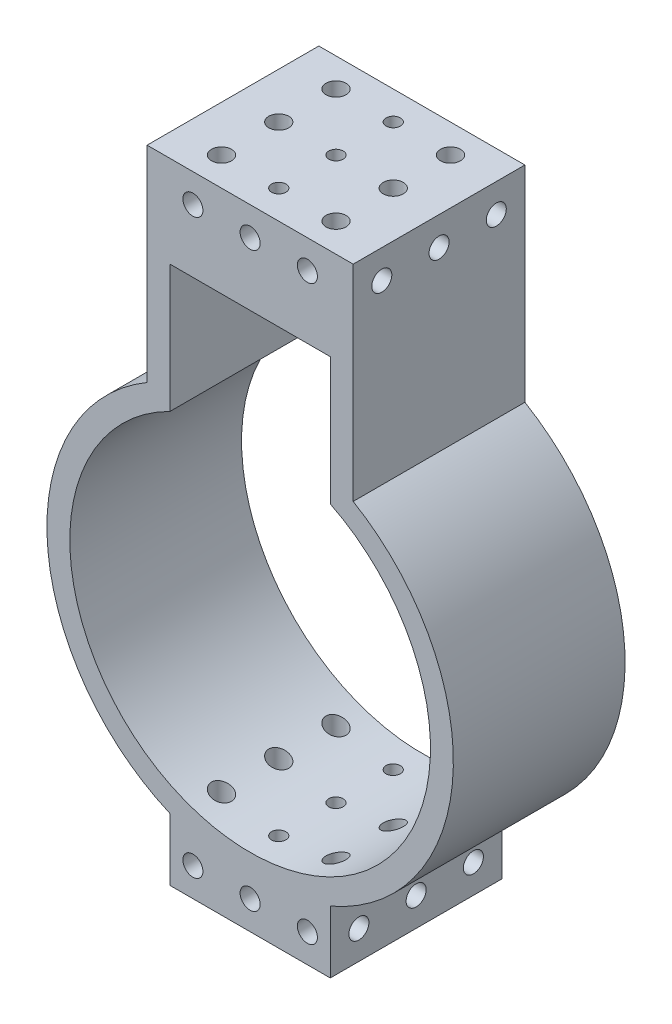
from build123d import *

# Parameters (mm, degrees)
BOSS_EXTRU_1_DEPTH      = 30
ESQUISSE3_W             = 36
ESQUISSE3_H             = 30
BOSS_EXTRU_2_DEPTH      = 12
ESQUISSE2_R             = 1.25
ESQUISSE2_R_2           = 1.75
ENL_V_MAT_EXTRU_1_DEPTH = 120.416288671
ESQUISSE4_R             = 1.75
ENL_V_MAT_EXTRU_2_DEPTH = 91.4682265
ESQUISSE5_R             = 1.75
ENL_V_MAT_EXTRU_3_DEPTH = 82.13260762


with BuildPart() as part:
    # Esquisse1 → Boss.-Extru.1 (new body)
    with BuildSketch(Plane.XY):
        with BuildLine():
            Line((18, 54.5), (18, 30.598202562))
            ThreePointArc((18, 30.598202562), (35.429157568, -2.241605229), (14, -32.622844756))
            Line((14, -32.622844756), (14, -43.5))
            Line((14, -43.5), (-14, -43.5))
            Line((-14, -43.5), (-14, -32.622844756))
            ThreePointArc((-14, -32.622844756), (-35.429157568, -2.241605229), (-18, 30.598202562))
            Line((-18, 30.598202562), (-18, 54.5))
            Line((-18, 54.5), (18, 54.5))
        make_face()
        with BuildLine():
            Line((-14, 28.217902119), (-14, 50.5))
            Line((-14, 50.5), (14, 50.5))
            Line((14, 50.5), (14, 28.217902119))
            ThreePointArc((14, 28.217902119), (0, -31.5), (-14, 28.217902119))
        make_face(mode=Mode.SUBTRACT)
    extrude(amount=BOSS_EXTRU_1_DEPTH)

    # Esquisse3 → Boss.-Extru.2 (add)
    with BuildSketch(Plane(origin=(0, 54.5, 0), x_dir=(1, 0, 0), z_dir=(0, 1, 0))):
        with Locations((0, -15)):
            Rectangle(ESQUISSE3_W, ESQUISSE3_H)
    extrude(amount=BOSS_EXTRU_2_DEPTH)

    # Esquisse2 → Enlèv. mat.-Extru.1 (cut, through all)
    with BuildSketch(Plane(origin=(0, 66.5, 0), x_dir=(1, 0, 0), z_dir=(0, 1, 0))):
        with Locations(Location((0, -5, 0), (0, 0, 180))):
            Circle(ESQUISSE2_R)
        with Locations(Location((0, -15, 0), (0, 0, 180))):
            Circle(ESQUISSE2_R)
        with Locations(Location((-10, -5, 0), (0, 0, 180))):
            Circle(ESQUISSE2_R_2)
        with Locations(Location((10, -5, 0), (0, 0, 180))):
            Circle(ESQUISSE2_R_2)
        with Locations(Location((10, -15, 0), (0, 0, 180))):
            Circle(ESQUISSE2_R_2)
        with Locations(Location((10, -25, 0), (0, 0, 180))):
            Circle(ESQUISSE2_R_2)
        with Locations(Location((-10, -15, 0), (0, 0, 180))):
            Circle(ESQUISSE2_R_2)
        with Locations(Location((-10, -25, 0), (0, 0, 180))):
            Circle(ESQUISSE2_R_2)
        with Locations(Location((0, -25, 0), (0, 0, 180))):
            Circle(ESQUISSE2_R)
    extrude(amount=-ENL_V_MAT_EXTRU_1_DEPTH, mode=Mode.SUBTRACT)

    # Esquisse4 → Enlèv. mat.-Extru.2 (cut, through all)
    with BuildSketch(Plane(origin=(18, 0, 0), x_dir=(0, 0, -1), z_dir=(1, 0, 0))):
        with Locations((-25, 61.5)):
            Circle(ESQUISSE4_R)
        with Locations((-15, 61.5)):
            Circle(ESQUISSE4_R)
        with Locations((-5, 61.5)):
            Circle(ESQUISSE4_R)
        with Locations((-5, -38.5)):
            Circle(ESQUISSE4_R)
        with Locations((-15, -38.5)):
            Circle(ESQUISSE4_R)
        with Locations((-25, -38.5)):
            Circle(ESQUISSE4_R)
    extrude(amount=-ENL_V_MAT_EXTRU_2_DEPTH, mode=Mode.SUBTRACT)

    # Esquisse5 → Enlèv. mat.-Extru.3 (cut, through all)
    with BuildSketch(Plane.XY.offset(30)):
        with Locations(Location((10, 61.5, 0), (0, 0, 315))):
            Circle(ESQUISSE5_R)
        with Locations(Location((0, 61.5, 0), (0, 0, 59.663584383))):
            Circle(ESQUISSE5_R)
        with Locations((-10, 61.5)):
            Circle(ESQUISSE5_R)
        with Locations(Location((0, -38.5, 0), (0, 0, 59.663584383))):
            Circle(ESQUISSE5_R)
        with Locations((-10, -38.5)):
            Circle(ESQUISSE5_R)
        with Locations(Location((10, -38.5, 0), (0, 0, 315))):
            Circle(ESQUISSE5_R)
    extrude(amount=-ENL_V_MAT_EXTRU_3_DEPTH, mode=Mode.SUBTRACT)


solid = part.part
